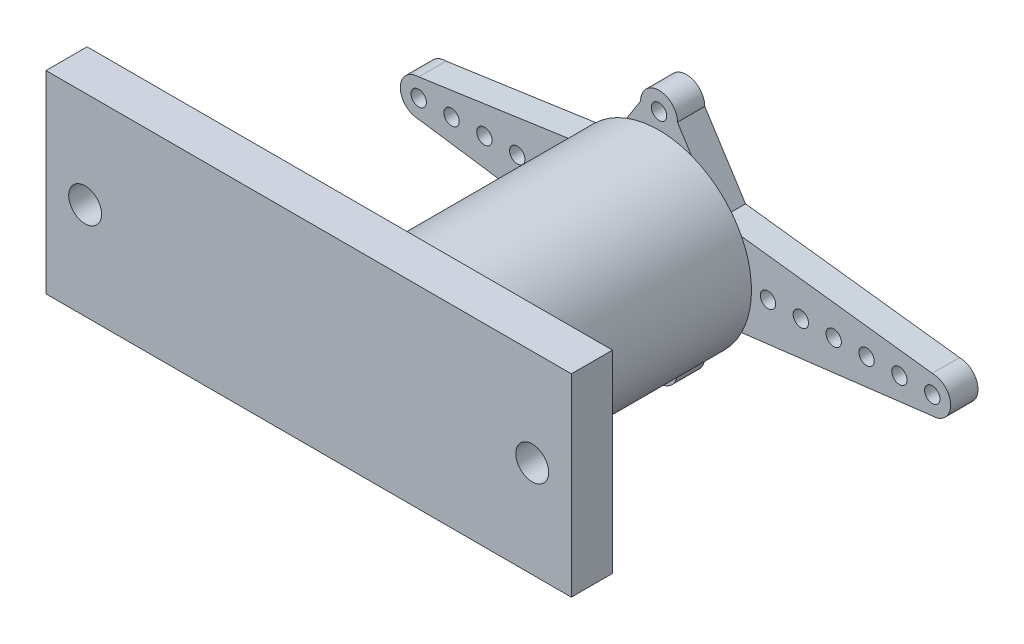
from build123d import *

# Parameters (mm, degrees)
SKETCH1_W           = 32.4866
SKETCH1_H           = 11.9634
SKETCH1_R           = 1.016
BOSS_EXTRUDE1_DEPTH = 2.54
SKETCH1_3_R         = 5.715
BOSS_EXTRUDE2_DEPTH = 13.4874
SKETCH2_R           = 18.034
BOSS_EXTRUDE3_DEPTH = 1.6891
SKETCH3_R           = 19.05
SKETCH3_R_2         = 0.475
CUT_EXTRUDE3_DEPTH  = 1.6891


with BuildPart() as part:
    # Sketch1 → Boss-Extrude1 (new body)
    with BuildSketch(Plane.XY):
        with Locations((-16.2433, 0)):
            Rectangle(SKETCH1_W, SKETCH1_H)
        with Locations((-2.41935, 0)):
            Circle(SKETCH1_R, mode=Mode.SUBTRACT)
        with Locations((-30.06725, 0)):
            Circle(SKETCH1_R, mode=Mode.SUBTRACT)
    extrude(amount=BOSS_EXTRUDE1_DEPTH)

    # Sketch1<3> → Boss-Extrude2 (add)
    with BuildSketch(Plane.XY):
        with Locations((-10.6045, 0)):
            Circle(SKETCH1_3_R)
    extrude(amount=-BOSS_EXTRUDE2_DEPTH)

    # Sketch2 → Boss-Extrude3 (add)
    with BuildSketch(Plane(origin=(0, 0, -13.4874), x_dir=(-1, 0, 0), z_dir=(0, 0, -1))):
        with Locations((10.6045, 0)):
            Circle(SKETCH2_R)
    extrude(amount=BOSS_EXTRUDE3_DEPTH)

    # Sketch3 → Cut-Extrude3 (cut)
    # profile 1 of 18: a face of its own
    with BuildSketch(Plane(origin=(0, 0, -15.1765), x_dir=(-1, 0, 0), z_dir=(0, 0, -1))):
        with Locations((10.6045, 0)):
            Circle(SKETCH3_R)
        with BuildLine():
            ThreePointArc((-6.2905, -1.139), (-7.4295, 0), (-6.2905, 1.139))
            Line((-6.2905, 1.139), (6.946568436, 2.752147304))
            Line((6.946568436, 2.752147304), (9.4655, 6.7095))
            ThreePointArc((9.4655, 6.7095), (10.6045, 7.8485), (11.7435, 6.7095))
            Line((11.7435, 6.7095), (14.262431564, 2.752147304))
            Line((14.262431564, 2.752147304), (25.466757758, 1.138999758))
            ThreePointArc((25.466757758, 1.138999758), (26.6065, 0), (25.466757758, -1.138999758))
            Line((25.466757758, -1.138999758), (14.262431564, -2.752147304))
            Line((14.262431564, -2.752147304), (11.7435, -6.7095))
            ThreePointArc((11.7435, -6.7095), (10.6045, -7.8485), (9.4655, -6.7095))
            Line((9.4655, -6.7095), (6.946568436, -2.752147304))
            Line((6.946568436, -2.752147304), (-6.2905, -1.139))
        make_face(mode=Mode.SUBTRACT)
    # profile 2 of 18: a face of its own
    with BuildSketch(Plane(origin=(0, 0, -15.1765), x_dir=(-1, 0, 0), z_dir=(0, 0, -1))):
        with Locations((15.3595, 0)):
            Circle(SKETCH3_R_2)
    # profile 3 of 18: a face of its own
    with BuildSketch(Plane(origin=(0, 0, -15.1765), x_dir=(-1, 0, 0), z_dir=(0, 0, -1))):
        with Locations((5.8495, 0)):
            Circle(SKETCH3_R_2)
    # profile 4 of 18: a face of its own
    with BuildSketch(Plane(origin=(0, 0, -15.1765), x_dir=(-1, 0, 0), z_dir=(0, 0, -1))):
        with Locations((17.3395, 0)):
            Circle(SKETCH3_R_2)
    # profile 5 of 18: a face of its own
    with BuildSketch(Plane(origin=(0, 0, -15.1765), x_dir=(-1, 0, 0), z_dir=(0, 0, -1))):
        with Locations((3.8695, 0)):
            Circle(SKETCH3_R_2)
    # profile 6 of 18: a face of its own
    with BuildSketch(Plane(origin=(0, 0, -15.1765), x_dir=(-1, 0, 0), z_dir=(0, 0, -1))):
        with Locations((1.8375, 0)):
            Circle(SKETCH3_R_2)
    # profile 7 of 18: a face of its own
    with BuildSketch(Plane(origin=(0, 0, -15.1765), x_dir=(-1, 0, 0), z_dir=(0, 0, -1))):
        with Locations((-0.1945, 0)):
            Circle(SKETCH3_R_2)
    # profile 8 of 18: a face of its own
    with BuildSketch(Plane(origin=(0, 0, -15.1765), x_dir=(-1, 0, 0), z_dir=(0, 0, -1))):
        with Locations((-2.2265, 0)):
            Circle(SKETCH3_R_2)
    # profile 9 of 18: a face of its own
    with BuildSketch(Plane(origin=(0, 0, -15.1765), x_dir=(-1, 0, 0), z_dir=(0, 0, -1))):
        with Locations((-4.2585, 0)):
            Circle(SKETCH3_R_2)
    # profile 10 of 18: a face of its own
    with BuildSketch(Plane(origin=(0, 0, -15.1765), x_dir=(-1, 0, 0), z_dir=(0, 0, -1))):
        with Locations((-6.2905, 0)):
            Circle(SKETCH3_R_2)
    # profile 11 of 18: a face of its own
    with BuildSketch(Plane(origin=(0, 0, -15.1765), x_dir=(-1, 0, 0), z_dir=(0, 0, -1))):
        with Locations((19.3715, 0)):
            Circle(SKETCH3_R_2)
    # profile 12 of 18: a face of its own
    with BuildSketch(Plane(origin=(0, 0, -15.1765), x_dir=(-1, 0, 0), z_dir=(0, 0, -1))):
        with Locations((21.4035, 0)):
            Circle(SKETCH3_R_2)
    # profile 13 of 18: a face of its own
    with BuildSketch(Plane(origin=(0, 0, -15.1765), x_dir=(-1, 0, 0), z_dir=(0, 0, -1))):
        with Locations((23.4355, 0)):
            Circle(SKETCH3_R_2)
    # profile 14 of 18: a face of its own
    with BuildSketch(Plane(origin=(0, 0, -15.1765), x_dir=(-1, 0, 0), z_dir=(0, 0, -1))):
        with Locations((25.4675, 0)):
            Circle(SKETCH3_R_2)
    # profile 15 of 18: a face of its own
    with BuildSketch(Plane(origin=(0, 0, -15.1765), x_dir=(-1, 0, 0), z_dir=(0, 0, -1))):
        with Locations((10.6045, 4.7295)):
            Circle(SKETCH3_R_2)
    # profile 16 of 18: a face of its own
    with BuildSketch(Plane(origin=(0, 0, -15.1765), x_dir=(-1, 0, 0), z_dir=(0, 0, -1))):
        with Locations((10.6045, -4.7295)):
            Circle(SKETCH3_R_2)
    # profile 17 of 18: a face of its own
    with BuildSketch(Plane(origin=(0, 0, -15.1765), x_dir=(-1, 0, 0), z_dir=(0, 0, -1))):
        with Locations((10.6045, 6.7095)):
            Circle(SKETCH3_R_2)
    # profile 18 of 18: a face of its own
    with BuildSketch(Plane(origin=(0, 0, -15.1765), x_dir=(-1, 0, 0), z_dir=(0, 0, -1))):
        with Locations((10.6045, -6.7095)):
            Circle(SKETCH3_R_2)
    extrude(amount=-CUT_EXTRUDE3_DEPTH, mode=Mode.SUBTRACT)


solid = part.part
